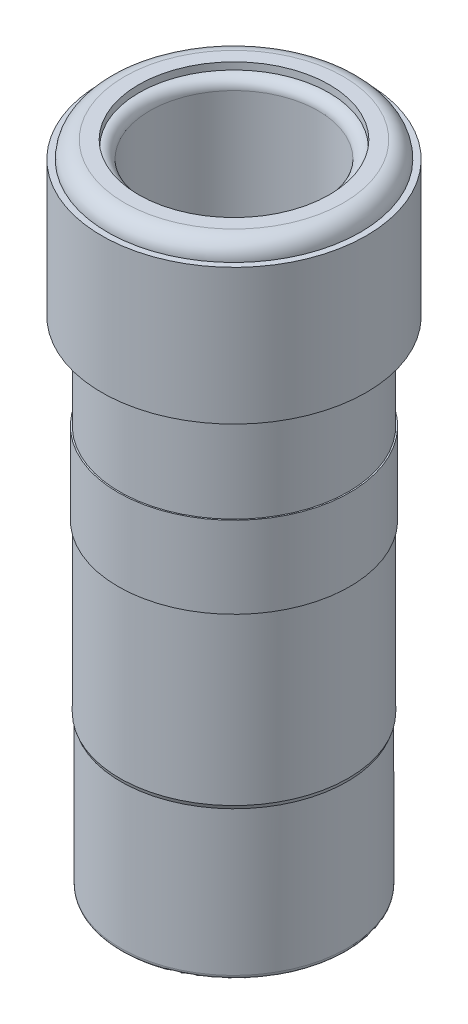
from build123d import *

# Parameters (mm, degrees)
ESBO_O3_R                  = 1.5
CORTE_EXTRUS_O1_DEPTH      = 1.8
CORTE_EXTRUS_O2_DEPTH      = 24.74931578
CORTE_EXTRUS_O2_DEPTH_BACK = 24.74931578
FILETE1_R                  = 0.2
ESBO_O12_R                 = 4.66979075
CORTE_EXTRUS_O3_DEPTH      = 4
ESBO_O15_R                 = 2.353382699
RESSALTO_EXTRUS_O2_DEPTH   = 1
FILETE2_R                  = 0.13
CORTE_EXTRUS_O4_DEPTH      = 20.400515457
CORTE_EXTRUS_O4_DEPTH_BACK = 20.400515457
ESBO_O16_R                 = 2.48
ESBO_O18_R                 = 2.48
RESSALTO_EXTRUS_O3_DEPTH   = 1.5
ESBO_O19_R                 = 0.75
RESSALTO_EXTRUS_O4_DEPTH   = 4
FILETE3_R                  = 0.5
ESBO_O20_R                 = 1.799226356
CORTE_EXTRUS_O5_DEPTH      = 10


with BuildPart() as part:
    # Esboço1 → Revolução1 (revolve)
    with BuildSketch(Plane.XY, mode=Mode.PRIVATE) as revolu_o1_sk:
        with BuildLine():
            Line((-3.37, 10.501320708), (-3.41, 10.501320708))
            Line((-3.41, 10.501320708), (-3.41, 8.101320708))
            Line((-3.41, 8.101320708), (-3.37, 8.101320708))
            Line((-3.37, 8.101320708), (-3.37, 4.101320708))
            Line((-3.37, 4.101320708), (-2.725, 2.329197773))
            Line((-2.725, 2.329197773), (-2.725, 0))
            Line((-2.725, 0), (0, 0))
            Line((0, 0), (0, 23.1))
            Line((0, 23.1), (-3.225, 23.1))
            ThreePointArc((-3.225, 23.1), (-3.578553391, 22.953553391), (-3.725, 22.6))
            Line((-3.725, 22.6), (-3.9, 22.6))
            Line((-3.9, 22.6), (-3.9, 18.6))
            Line((-3.9, 18.6), (-3.37, 18.6))
            Line((-3.37, 18.6), (-3.37, 15.8))
            Line((-3.37, 15.8), (-3.43, 15.8))
            Line((-3.43, 15.8), (-3.43, 13.4))
            Line((-3.43, 13.4), (-3.37, 13.4))
            Line((-3.37, 13.4), (-3.37, 10.501320708))
        make_face()
    revolve(revolu_o1_sk.sketch.rotate(Axis((0, 0, 0), (0, 1, 0)), 180), axis=Axis((0, 0, 0), (0, 1, 0)))

    # Esboço3 → Corte-extrusão1 (cut)
    with BuildSketch(Plane.XZ):
        Circle(ESBO_O3_R)
    extrude(amount=-CORTE_EXTRUS_O1_DEPTH, mode=Mode.SUBTRACT)

    # Esboço5 → Corte-extrusão2 (cut, two sides: drawn at the far end of the back side and taken through both)
    with BuildSketch(Plane(origin=(0, 0, 0), x_dir=(0, 0, -1), z_dir=(1, 0, 0)).offset(-CORTE_EXTRUS_O2_DEPTH_BACK)):
        Polygon((-0.589187623, 0), (0.589187623, 0), (0.4, 1.8), (-0.4, 1.8), align=None)
    extrude(amount=CORTE_EXTRUS_O2_DEPTH + CORTE_EXTRUS_O2_DEPTH_BACK, mode=Mode.SUBTRACT)

    # Esboço6 → Corte-Revolução1 (revolve, cut)
    with BuildSketch(Plane.XY, mode=Mode.PRIVATE) as corte_revolu_o1_sk:
        with BuildLine():
            Line((2.810516533, 23.1), (0, 23.1))
            Line((0, 23.1), (0, 22.6))
            Line((0, 22.6), (0, 3.9))
            ThreePointArc((0, 3.9), (0.790569415, 3.771708245), (1.5, 3.4))
            Line((1.5, 3.4), (1.75, 3.4))
            Line((1.75, 3.4), (1.75, 6.491111566))
            Line((1.75, 6.491111566), (2.45, 9.103547132))
            Line((2.45, 9.103547132), (2.45, 9.822456454))
            Line((2.45, 9.822456454), (2.26, 10.9))
            Line((2.26, 10.9), (2.46, 10.9))
            Line((2.46, 10.9), (2.46, 12.094100045))
            Line((2.46, 12.094100045), (2.265, 13.2))
            Line((2.265, 13.2), (2.465, 13.2))
            Line((2.465, 13.2), (2.48, 16.765743636))
            Line((2.48, 16.765743636), (2.28, 17.9))
            Line((2.28, 17.9), (2.48, 17.9))
            Line((2.48, 17.9), (2.48, 22.6))
            ThreePointArc((2.48, 22.6), (2.575060985, 22.819089023), (2.8, 22.899332591))
            Line((2.8, 22.899332591), (2.810516533, 23.1))
        make_face()
    revolve(corte_revolu_o1_sk.sketch.rotate(Axis((0, 22.6, 0), (0, -1, 0)), 180), axis=Axis((0, 22.6, 0), (0, -1, 0)), mode=Mode.SUBTRACT)

    # Filete1
    filete1_edges = [part.edges().sort_by_distance(p)[0] for p in [
        (1.75, 3.4, 0),
    ]]
    fillet(filete1_edges, radius=FILETE1_R)

    # Esboço9 → Corte-Revolução2 (revolve, cut)
    with BuildSketch(Plane.XY, mode=Mode.PRIVATE) as corte_revolu_o2_sk:
        Polygon((-6.004910607, 22.6), (-3.9, 22.6), (-3.9, 18.6), (-3.37, 18.6), (-3.37, 15.8), (-3.41, 15.8), (-3.41, 13.4), (-3.37, 13.4), (-3.37, 8.491421612), (-3.33, 8.381522515), (-3.33, 3.991421612), (-2.725, 2.329197773), (-6.004910607, 2.329197773), align=None)
    revolve(corte_revolu_o2_sk.sketch.rotate(Axis((0, 0, 0), (0, 1, 0)), 270), axis=Axis((0, 0, 0), (0, 1, 0)), mode=Mode.SUBTRACT)

    # Esboço12 → Corte-extrusão3 (cut)
    with BuildSketch(Plane.XZ):
        Circle(ESBO_O12_R)
    extrude(amount=-CORTE_EXTRUS_O3_DEPTH, mode=Mode.SUBTRACT)

    # Esboço15 → Ressalto-extrusão2 (add)
    with BuildSketch(Plane(origin=(0, 4.5, 0), x_dir=(-1, 0, 0), z_dir=(0, -1, 0))):
        Circle(ESBO_O15_R)
    extrude(amount=-RESSALTO_EXTRUS_O2_DEPTH)

    # Filete2
    filete2_edges = [part.edges().sort_by_distance(p)[0] for p in [
        (1.75, 4, 0),
        (0, 4, 3.33),
        (1.75, 6.491111566, 0),
        (2.45, 9.103547132, 0),
    ]]
    fillet(filete2_edges, radius=FILETE2_R)

    # Esboço16 → Corte-extrusão4 (cut, two sides: drawn at the far end of the back side and taken through both)
    with BuildSketch(Plane.XZ.offset(-4.5).offset(-CORTE_EXTRUS_O4_DEPTH_BACK)):
        with Locations(Location((0, 0, 0), (0, 0, 180))):
            Circle(ESBO_O16_R)
    extrude(amount=CORTE_EXTRUS_O4_DEPTH + CORTE_EXTRUS_O4_DEPTH_BACK, mode=Mode.SUBTRACT)

    # Esboço18 → Ressalto-extrusão3 (add)
    with BuildSketch(Plane(origin=(0, 8, 0), x_dir=(-1, 0, 0), z_dir=(0, -1, 0))):
        Circle(ESBO_O18_R)
    extrude(amount=-RESSALTO_EXTRUS_O3_DEPTH)

    # Esboço19 → Ressalto-extrusão4 (add)
    with BuildSketch(Plane.XZ.offset(-8)):
        Circle(ESBO_O19_R)
    extrude(amount=RESSALTO_EXTRUS_O4_DEPTH)

    # Filete3
    filete3_edges = [part.edges().sort_by_distance(p)[0] for p in [
        (-0.75, 4, 0),
    ]]
    fillet(filete3_edges, radius=FILETE3_R)

    # Esboço20 → Corte-extrusão5 (cut)
    with BuildSketch(Plane(origin=(0, 9.5, 0), x_dir=(1, 0, 0), z_dir=(0, 1, 0))):
        with Locations(Location((0, 0, 0), (0, 0, 180))):
            Circle(ESBO_O20_R)
    extrude(amount=-CORTE_EXTRUS_O5_DEPTH, mode=Mode.SUBTRACT)


solid = part.part
